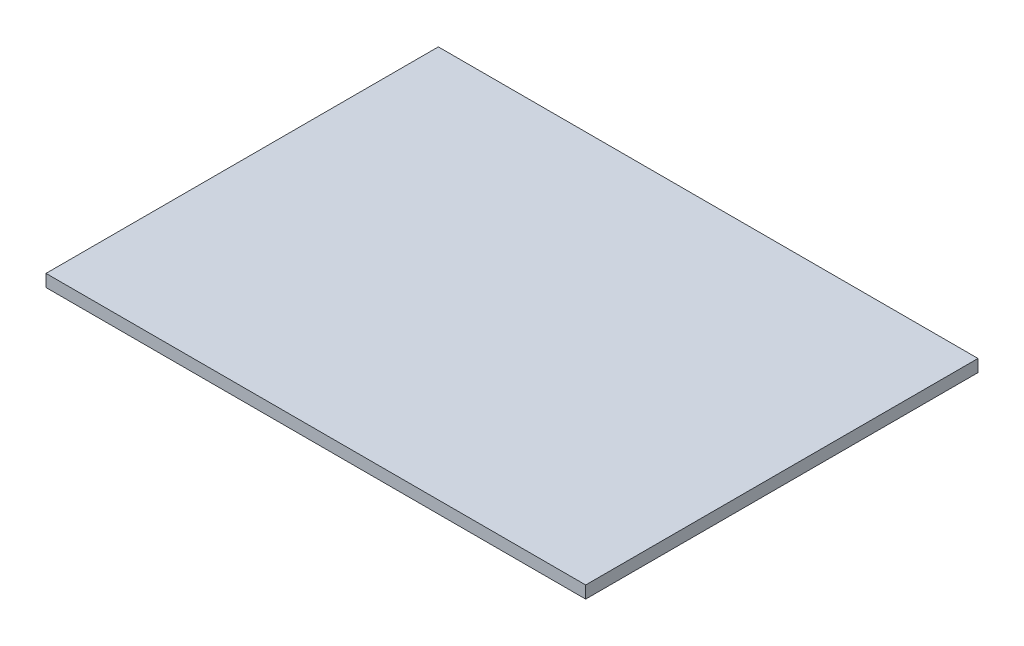
from build123d import *

# Parameters (mm, degrees)
SKETCH1_W           = 203.11355437
SKETCH1_H           = 6.360048153
BOSS_EXTRUDE1_DEPTH = 279.4


with BuildPart() as part:
    # Sketch1 → Boss-Extrude1 (new body)
    with BuildSketch(Plane(origin=(0, 0, 0), x_dir=(0, 0, -1), z_dir=(1, 0, 0))):
        with Locations((101.556777185, -3.180024077)):
            Rectangle(SKETCH1_W, SKETCH1_H)
    extrude(amount=BOSS_EXTRUDE1_DEPTH)


solid = part.part
